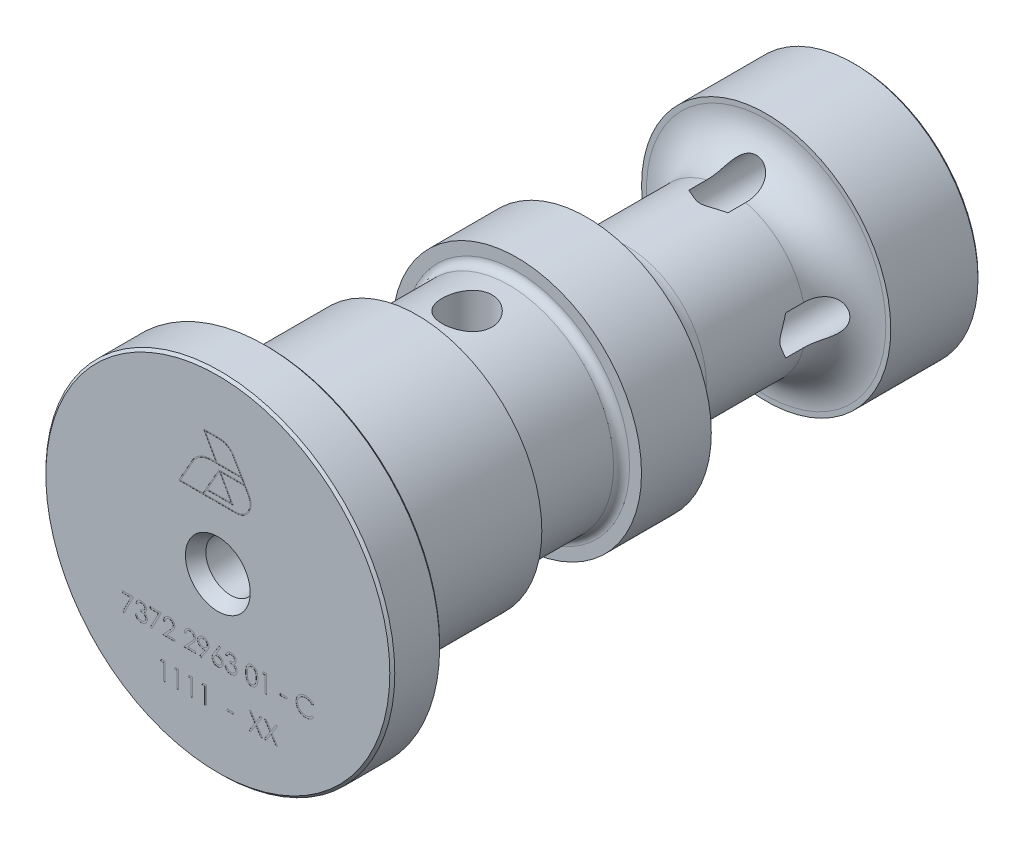
from build123d import *

# Parameters (mm, degrees)
CIRPATTERN1_COUNT       = 4
CUT_EXTRUDE2_DEPTH      = 69.618510622
CUT_EXTRUDE2_DEPTH_BACK = 69.618510622
SKETCH4_R               = 2.5
SKETCH5_W               = 0.692307692
SKETCH5_H               = 0.184615385
CUT_EXTRUDE3_DEPTH      = 0.01


with BuildPart() as part:
    # Sketch1 → Revolve1 (revolve)
    with BuildSketch(Plane(origin=(0, 0, 0), x_dir=(0, 0, -1), z_dir=(1, 0, 0)), mode=Mode.PRIVATE) as revolve1_sk:
        with BuildLine():
            Line((0, 3.25), (0, 17.25))
            Line((0, 17.25), (0.25, 17.5))
            Line((0.25, 17.5), (4.75, 17.5))
            Line((4.75, 17.5), (5, 17.25))
            Line((5, 17.25), (5, 14.4975))
            ThreePointArc((5, 14.4975), (5.585786438, 13.083286438), (7, 12.4975))
            Line((7, 12.4975), (20, 12.4975))
            Line((20, 12.4975), (20, 11.3))
            ThreePointArc((20, 11.3), (20.234314575, 10.734314575), (20.8, 10.5))
            Line((20.8, 10.5), (29.2, 10.5))
            ThreePointArc((29.2, 10.5), (29.765685425, 10.734314575), (30, 11.3))
            Line((30, 11.3), (30, 12.4975))
            Line((30, 12.4975), (37, 12.4975))
            Line((37, 12.4975), (37, 12))
            ThreePointArc((37, 12), (38.171572875, 9.171572875), (41, 8))
            Line((41, 8), (51, 8))
            ThreePointArc((51, 8), (53.828427125, 9.171572875), (55, 12))
            Line((55, 12), (55, 12.4975))
            Line((55, 12.4975), (63.75, 12.4975))
            Line((63.75, 12.4975), (64, 12.2475))
            Line((64, 12.2475), (64, 10))
            Line((64, 10), (63.5, 9.5))
            Line((63.5, 9.5), (60.25, 9.5))
            ThreePointArc((60.25, 9.5), (59.366116524, 9.133883476), (59, 8.25))
            Line((59, 8.25), (59, 4.25))
            Line((59, 4.25), (57.718282402, 3.51))
            Line((57.718282402, 3.51), (33, 3.51))
            Line((33, 3.51), (33, 3.4))
            Line((33, 3.4), (22.042926105, 3.4))
            Line((22.042926105, 3.4), (20, 0))
            Line((20, 0), (11, 0))
            Line((11, 0), (9.497848452, 2.5))
            Line((9.497848452, 2.5), (1.299038106, 2.5))
            Line((1.299038106, 2.5), (0, 3.25))
        make_face()
    revolve(revolve1_sk.sketch.rotate(Axis((0, 0, 67.498669623), (0, 0, -1)), 90), axis=Axis((0, 0, 67.498669623), (0, 0, -1)))

    # Sketch3 → Cut-Revolve3 (revolve, cut)
    with BuildSketch(Plane(origin=(0, 0, 0), x_dir=(0, 0, -1), z_dir=(1, 0, 0)), mode=Mode.PRIVATE) as cut_revolve3_sk:
        Polygon((66.818419238, -7.375), (66.818419238, -9.375), (49.201721238, -9.375), (48, -7.375), align=None)
    cut_revolve3 = revolve(cut_revolve3_sk.sketch.rotate(Axis((0, -7.375, -68.053965544), (0, 0, 1)), 79.038560762), axis=Axis((0, -7.375, -68.053965544), (0, 0, 1)), mode=Mode.SUBTRACT)

    # CirPattern1: Cut-Revolve3 ×4 about axis
    cirpattern1_axis = Axis((0, 0, 0), (0, 0, 1))
    for i in range(1, CIRPATTERN1_COUNT):
        add(cut_revolve3.rotate(cirpattern1_axis, i * 360 / CIRPATTERN1_COUNT), mode=Mode.SUBTRACT)

    # Sketch4 → Cut-Extrude2 (cut, two sides: drawn at the far end of the back side and taken through both)
    with BuildSketch(Plane(origin=(0, 0, 0), x_dir=(1, 0, 0), z_dir=(0, 1, 0)).offset(-CUT_EXTRUDE2_DEPTH_BACK)):
        with Locations(Location((0, 25, 0), (0, 0, 270))):
            Circle(SKETCH4_R)
    extrude(amount=CUT_EXTRUDE2_DEPTH + CUT_EXTRUDE2_DEPTH_BACK, mode=Mode.SUBTRACT)

    # Sketch5 → Cut-Extrude3 (cut)
    # profile 1 of 20: a face of its own
    with BuildSketch(Plane.XY):
        Polygon((-9.553846154, -6.221311831), (-8.446153846, -6.221311831), (-9.392307692, -8.067465677), (-9.531850962, -7.990662792), (-8.719831731, -6.405927215), (-9.553846154, -6.405927215), align=None)
    # profile 2 of 20: a face of its own
    with BuildSketch(Plane.XY):
        with BuildLine():
            Line((-8.053846154, -6.636696446), (-8.215384615, -6.636696446))
            add(Edge.make_bspline(
                [(-8.215384615, -6.636696446), (-8.211008275, -6.618576883), (-8.202452888, -6.583154619), (-8.184608421, -6.532545171), (-8.165168804, -6.484653074), (-8.141825836, -6.440375093), (-8.116364191, -6.398821372), (-8.087192506, -6.360934393), (-8.055656649, -6.325750583), (-8.020775246, -6.294526632), (-7.984194791, -6.266252371), (-7.945399844, -6.242145199), (-7.905170927, -6.221407063), (-7.863229316, -6.204322372), (-7.819450142, -6.191452103), (-7.774229193, -6.182114317), (-7.727447964, -6.176050316), (-7.695692061, -6.175458495), (-7.679567308, -6.175157985)],
                knots=[0, 0, 0, 0, 1.162005537, 2.271625781, 3.343758855, 4.383309926, 5.390229558, 6.379919256, 7.361854164, 8.333198761, 9.295911338, 10.242430842, 11.177959212, 12.116337295, 13.062827104, 14.020064771, 14.994644689, 16, 16, 16, 16], degree=3))
            add(Edge.make_bspline(
                [(-7.679567308, -6.175157985), (-7.656073326, -6.175867303), (-7.609597835, -6.177270468), (-7.541319696, -6.190083606), (-7.475477332, -6.210359389), (-7.412791433, -6.238374448), (-7.354564811, -6.272927924), (-7.302757629, -6.314052646), (-7.258072109, -6.360955143), (-7.220583572, -6.412760462), (-7.191230715, -6.468126153), (-7.169586295, -6.525109091), (-7.15640943, -6.583574105), (-7.154701715, -6.623049277), (-7.153846154, -6.642826254)],
                knots=[0, 0, 0, 0, 1.083050992, 2.142477498, 3.193116406, 4.255571735, 5.30263384, 6.308962982, 7.297363603, 8.282367274, 9.249857812, 10.179914175, 11.08814088, 12, 12, 12, 12], degree=3))
            add(Edge.make_bspline(
                [(-7.153846154, -6.642826254), (-7.154444572, -6.66185832), (-7.155615584, -6.699101119), (-7.165558632, -6.753472175), (-7.182291568, -6.804716426), (-7.205470303, -6.853049596), (-7.235474528, -6.898165227), (-7.271820487, -6.940164828), (-7.314764713, -6.979234681), (-7.347308167, -7.001616124), (-7.3640625, -7.013138754)],
                knots=[0, 0, 0, 0, 1.024540389, 2.004866551, 2.965041327, 3.920577974, 4.882998113, 5.874504559, 6.905732034, 8, 8, 8, 8], degree=3))
            add(Edge.make_bspline(
                [(-7.3640625, -7.013138754), (-7.344914741, -7.022384671), (-7.306977491, -7.040703506), (-7.25526579, -7.076629324), (-7.208322883, -7.118109731), (-7.182143827, -7.150480239), (-7.168990385, -7.166744523)],
                knots=[0, 0, 0, 0, 1.015518401, 2.012035669, 3.001164323, 4, 4, 4, 4], degree=3))
            add(Edge.make_bspline(
                [(-7.168990385, -7.166744523), (-7.160329123, -7.178602795), (-7.143148433, -7.202125152), (-7.121941588, -7.239943886), (-7.102702614, -7.278181795), (-7.087711073, -7.317863775), (-7.076101656, -7.358529896), (-7.067803125, -7.400249986), (-7.062647853, -7.443058111), (-7.061909569, -7.472018815), (-7.061538462, -7.486576254)],
                knots=[0, 0, 0, 0, 1.025084078, 2.033381695, 3.024893161, 4.013698104, 4.991890475, 5.976764909, 6.982997093, 8, 8, 8, 8], degree=3))
            add(Edge.make_bspline(
                [(-7.061538462, -7.486576254), (-7.062461354, -7.511781253), (-7.064302796, -7.562072637), (-7.080762035, -7.636373923), (-7.106277416, -7.709004181), (-7.142512411, -7.778471241), (-7.186672844, -7.843466866), (-7.239210897, -7.901620396), (-7.299529621, -7.95160825), (-7.366801098, -7.99337351), (-7.439684192, -8.02675987), (-7.517637354, -8.049932269), (-7.599537382, -8.065024497), (-7.655701135, -8.066642887), (-7.684254808, -8.067465677)],
                knots=[0, 0, 0, 0, 0.955779014, 1.907060117, 2.875433937, 3.871313158, 4.872415639, 5.851225146, 6.836215519, 7.83643374, 8.849228613, 9.86973379, 10.916971861, 12, 12, 12, 12], degree=3))
            add(Edge.make_bspline(
                [(-7.684254808, -8.067465677), (-7.703499019, -8.067019167), (-7.74136521, -8.066140585), (-7.797033295, -8.060134447), (-7.850170169, -8.04916473), (-7.900847677, -8.034403031), (-7.949110838, -8.015687277), (-7.994812378, -7.992380518), (-8.038233466, -7.964963175), (-8.078964355, -7.933111615), (-8.11700019, -7.897481212), (-8.151330163, -7.857439435), (-8.182526628, -7.813726485), (-8.20975427, -7.765834627), (-8.234253275, -7.714382781), (-8.254403481, -7.658712124), (-8.272138916, -7.599320342), (-8.280384698, -7.557931789), (-8.284615385, -7.536696446)],
                knots=[0, 0, 0, 0, 1.048658725, 2.063410685, 3.046034179, 4.001477787, 4.936774919, 5.862367409, 6.792675028, 7.730719943, 8.675894397, 9.627829632, 10.600096036, 11.597688215, 12.626045268, 13.701542398, 14.82072376, 16, 16, 16, 16], degree=3))
            Line((-8.284615385, -7.536696446), (-8.123076923, -7.536696446))
            add(Edge.make_bspline(
                [(-8.123076923, -7.536696446), (-8.118868373, -7.550555939), (-8.110682378, -7.577513856), (-8.096748168, -7.616311727), (-8.080873056, -7.651878726), (-8.063842712, -7.68447576), (-8.045956654, -7.714423853), (-8.025943264, -7.7409311), (-8.005284846, -7.765161775), (-7.989712608, -7.77881329), (-7.982091346, -7.785494523)],
                knots=[0, 0, 0, 0, 1.198163088, 2.33053128, 3.407730985, 4.417276592, 5.372219308, 6.28897303, 7.162600585, 8, 8, 8, 8], degree=3))
            add(Edge.make_bspline(
                [(-7.982091346, -7.785494523), (-7.972013107, -7.793264523), (-7.951887737, -7.80878054), (-7.919092647, -7.828581377), (-7.884602134, -7.845738476), (-7.847668873, -7.858844377), (-7.809089848, -7.869941459), (-7.768241489, -7.877203441), (-7.725484177, -7.882185929), (-7.696289328, -7.882625608), (-7.681370192, -7.882850292)],
                knots=[0, 0, 0, 0, 0.946170439, 1.889420265, 2.845303464, 3.807233317, 4.801018734, 5.828864929, 6.890507805, 8, 8, 8, 8], degree=3))
            add(Edge.make_bspline(
                [(-7.681370192, -7.882850292), (-7.664525534, -7.882533541), (-7.631587258, -7.881914161), (-7.583524759, -7.876218084), (-7.537800929, -7.867922442), (-7.494923424, -7.855110051), (-7.454330592, -7.839279899), (-7.416591458, -7.819403576), (-7.381210603, -7.796083434), (-7.348641195, -7.769577581), (-7.319354934, -7.740560812), (-7.293568898, -7.710211232), (-7.271647644, -7.678656806), (-7.253964661, -7.645722915), (-7.240001521, -7.61154594), (-7.230495875, -7.576029971), (-7.223886524, -7.539465662), (-7.223348266, -7.514610764), (-7.223076923, -7.502081062)],
                knots=[0, 0, 0, 0, 1.217147791, 2.380027433, 3.494444702, 4.572153297, 5.609568379, 6.639424714, 7.649109417, 8.668170816, 9.669597737, 10.625200337, 11.543417969, 12.441394052, 13.322311151, 14.205496177, 15.095365482, 16, 16, 16, 16], degree=3))
            add(Edge.make_bspline(
                [(-7.223076923, -7.502081062), (-7.223863935, -7.485309516), (-7.225434044, -7.451849877), (-7.237421313, -7.402623696), (-7.257138443, -7.355194513), (-7.284741449, -7.310371535), (-7.318342681, -7.268829643), (-7.357616062, -7.231764309), (-7.402887722, -7.201179691), (-7.444555083, -7.180048382), (-7.481462878, -7.165629314), (-7.513047933, -7.156025047), (-7.548408472, -7.14789231), (-7.58711688, -7.140325999), (-7.62946482, -7.133886448), (-7.675406188, -7.128516372), (-7.724950294, -7.124219493), (-7.759248607, -7.122300644), (-7.776923077, -7.121311831)],
                knots=[0, 0, 0, 0, 1.07054697, 2.135767047, 3.216561865, 4.33974944, 5.486079747, 6.621378074, 7.775625952, 8.963672916, 9.598146892, 10.304877434, 11.070270905, 11.915000392, 12.823868403, 13.805723172, 14.86925407, 16, 16, 16, 16], degree=3))
            Line((-7.776923077, -7.121311831), (-7.776923077, -6.936696446))
            add(Edge.make_bspline(
                [(-7.776923077, -6.936696446), (-7.754653906, -6.936318547), (-7.711034071, -6.935578336), (-7.647317, -6.926625645), (-7.586387868, -6.914241322), (-7.529596972, -6.895271794), (-7.477834776, -6.873239642), (-7.432927552, -6.847601362), (-7.395504448, -6.819102348), (-7.365747326, -6.787302721), (-7.343360865, -6.753197839), (-7.326992798, -6.71765213), (-7.317324059, -6.680354041), (-7.316033373, -6.65489964), (-7.315384615, -6.6421051)],
                knots=[0, 0, 0, 0, 1.321986639, 2.589447074, 3.816329219, 5.01088745, 6.139805852, 7.153945165, 8.075214402, 8.924034688, 9.728124013, 10.488707548, 11.240355623, 12, 12, 12, 12], degree=3))
            add(Edge.make_bspline(
                [(-7.315384615, -6.6421051), (-7.315597741, -6.632705117), (-7.316021744, -6.614004296), (-7.321368916, -6.586682832), (-7.329404137, -6.560196631), (-7.340450855, -6.534658329), (-7.355236671, -6.510245045), (-7.372931179, -6.486748643), (-7.394000487, -6.464303271), (-7.41814386, -6.443381964), (-7.444069931, -6.423443499), (-7.472484101, -6.406516486), (-7.502529637, -6.392041882), (-7.534239802, -6.380105567), (-7.567717503, -6.371126504), (-7.602805447, -6.3646795), (-7.639570542, -6.360648706), (-7.664653147, -6.360068378), (-7.677403846, -6.359773369)],
                knots=[0, 0, 0, 0, 0.884392785, 1.759457502, 2.611959086, 3.489218968, 4.37281399, 5.2945488, 6.255912374, 7.266815255, 8.301784654, 9.332968512, 10.37626691, 11.440494194, 12.520033166, 13.637162961, 14.798855837, 16, 16, 16, 16], degree=3))
            add(Edge.make_bspline(
                [(-7.677403846, -6.359773369), (-7.69789899, -6.360488927), (-7.737930772, -6.361886577), (-7.795641301, -6.374128127), (-7.849291244, -6.393659713), (-7.890299701, -6.416973837), (-7.920582168, -6.439988346), (-7.942221736, -6.460087859), (-7.963472284, -6.48242474), (-7.982935775, -6.508374761), (-8.002619534, -6.536180539), (-8.020539595, -6.567255575), (-8.037953151, -6.600789264), (-8.04844589, -6.62449559), (-8.053846154, -6.636696446)],
                knots=[0, 0, 0, 0, 1.472543308, 2.876219568, 4.221790263, 5.565193594, 6.249813518, 6.953379497, 7.687249741, 8.463570142, 9.283606569, 10.136032583, 11.040678096, 12, 12, 12, 12], degree=3))
        make_face()
    # profile 3 of 20: a face of its own
    with BuildSketch(Plane.XY):
        Polygon((-6.784615385, -6.221311831), (-5.676923077, -6.221311831), (-6.623076923, -8.067465677), (-6.762620192, -7.990662792), (-5.950600962, -6.405927215), (-6.784615385, -6.405927215), align=None)
    # profile 4 of 20: a face of its own
    with BuildSketch(Plane.XY):
        with BuildLine():
            Line((-5.284615385, -6.775157985), (-5.446153846, -6.775157985))
            add(Edge.make_bspline(
                [(-5.446153846, -6.775157985), (-5.445101025, -6.753727242), (-5.443033311, -6.711637835), (-5.433350191, -6.650271254), (-5.419494883, -6.591614501), (-5.399904992, -6.536138545), (-5.375576049, -6.483352873), (-5.346400606, -6.43346715), (-5.311843769, -6.386671682), (-5.272651734, -6.343400277), (-5.230085006, -6.303703812), (-5.184156237, -6.269423973), (-5.13589308, -6.240460599), (-5.085441961, -6.216247389), (-5.032233671, -6.198072611), (-4.976751058, -6.184587196), (-4.918750359, -6.176473647), (-4.879232634, -6.175601529), (-4.859134615, -6.175157985)],
                knots=[0, 0, 0, 0, 1.10065271, 2.161652631, 3.183658789, 4.190468796, 5.17591951, 6.163126047, 7.15150782, 8.156236427, 9.156009102, 10.134482811, 11.092018607, 12.041330605, 13.001268258, 13.972401359, 14.968799086, 16, 16, 16, 16], degree=3))
            add(Edge.make_bspline(
                [(-4.859134615, -6.175157985), (-4.83939732, -6.175620048), (-4.80061424, -6.176527986), (-4.744010918, -6.184325087), (-4.690125453, -6.196537105), (-4.639063173, -6.213670748), (-4.591231482, -6.236702739), (-4.546271059, -6.264370045), (-4.503646642, -6.296368815), (-4.465277439, -6.334042205), (-4.430044713, -6.374260574), (-4.399649267, -6.41719721), (-4.373619641, -6.4615437), (-4.351923119, -6.507638204), (-4.335951391, -6.555914733), (-4.323825455, -6.605670437), (-4.316971357, -6.65742034), (-4.315919425, -6.692446568), (-4.315384615, -6.710254139)],
                knots=[0, 0, 0, 0, 1.111607364, 2.184268762, 3.212621178, 4.221274766, 5.211760367, 6.196651075, 7.1921475, 8.207485113, 9.220403448, 10.201281604, 11.166441695, 12.114753415, 13.065576456, 14.026450734, 14.996634279, 16, 16, 16, 16], degree=3))
            add(Edge.make_bspline(
                [(-4.315384615, -6.710254139), (-4.316252033, -6.735325469), (-4.317971646, -6.785028164), (-4.332811721, -6.858161833), (-4.355739657, -6.929084435), (-4.383548643, -6.986159376), (-4.411639221, -7.031918921), (-4.436417402, -7.06993268), (-4.466067183, -7.110471979), (-4.500317281, -7.153945121), (-4.53865101, -7.200485083), (-4.581344268, -7.250110963), (-4.628723194, -7.302295691), (-4.661975974, -7.337938681), (-4.679206731, -7.356407985)],
                knots=[0, 0, 0, 0, 1.184203166, 2.347625244, 3.513805382, 4.700623107, 5.337941753, 6.051866363, 6.845199593, 7.711357327, 8.668078039, 9.695487809, 10.805859518, 12, 12, 12, 12], degree=3))
            Line((-4.679206731, -7.356407985), (-5.129567308, -7.836696446))
            Line((-5.129567308, -7.836696446), (-4.292307692, -7.836696446))
            Line((-4.292307692, -7.836696446), (-4.292307692, -8.021311831))
            Line((-4.292307692, -8.021311831), (-5.515384615, -8.021311831))
            Line((-5.515384615, -8.021311831), (-4.817307692, -7.276359908))
            add(Edge.make_bspline(
                [(-4.817307692, -7.276359908), (-4.800311636, -7.258617922), (-4.767665691, -7.224539197), (-4.721491794, -7.174785675), (-4.680020315, -7.128628768), (-4.642982798, -7.086155686), (-4.61118271, -7.046745165), (-4.582962705, -7.011673603), (-4.560351829, -6.979399886), (-4.535812483, -6.941990428), (-4.512045293, -6.896315522), (-4.491621795, -6.840498196), (-4.479168445, -6.783038466), (-4.477674529, -6.744208847), (-4.476923077, -6.724677215)],
                knots=[0, 0, 0, 0, 1.329631726, 2.553950428, 3.673215718, 4.687767853, 5.603093632, 6.413772471, 7.123043292, 7.734684054, 8.834405432, 9.900288307, 10.943827018, 12, 12, 12, 12], degree=3))
            add(Edge.make_bspline(
                [(-4.476923077, -6.724677215), (-4.47725003, -6.712395353), (-4.477894392, -6.688190162), (-4.483581208, -6.652701486), (-4.492175182, -6.618468153), (-4.504489887, -6.585384863), (-4.520744782, -6.553784242), (-4.540531091, -6.523627824), (-4.563360267, -6.494473499), (-4.589769491, -6.467137517), (-4.61878113, -6.442101468), (-4.649429601, -6.419923367), (-4.681855369, -6.401388967), (-4.715921717, -6.386195169), (-4.751533673, -6.374276401), (-4.788760113, -6.366017703), (-4.827498179, -6.360832426), (-4.853949691, -6.360130852), (-4.867427885, -6.359773369)],
                knots=[0, 0, 0, 0, 0.991446411, 1.95395049, 2.89581595, 3.838931463, 4.798493298, 5.75982156, 6.748411868, 7.785213223, 8.824556874, 9.840280684, 10.836137867, 11.835679398, 12.848801643, 13.863922112, 14.911575587, 16, 16, 16, 16], degree=3))
            add(Edge.make_bspline(
                [(-4.867427885, -6.359773369), (-4.881504313, -6.3601411), (-4.909148094, -6.360863263), (-4.949735025, -6.365914919), (-4.988453425, -6.374629922), (-5.025400689, -6.386549355), (-5.060639333, -6.401699466), (-5.093997985, -6.420569506), (-5.125401756, -6.443086731), (-5.154909683, -6.46861616), (-5.182096872, -6.497039498), (-5.205983836, -6.528724621), (-5.226855615, -6.563093006), (-5.245066078, -6.600051918), (-5.259854719, -6.639936719), (-5.271155196, -6.682605825), (-5.280097003, -6.727873964), (-5.283084242, -6.759134864), (-5.284615385, -6.775157985)],
                knots=[0, 0, 0, 0, 1.031018746, 2.02475058, 2.990194455, 3.934040569, 4.864654155, 5.795059489, 6.735614925, 7.690564532, 8.649604399, 9.611025574, 10.590972636, 11.591080095, 12.624614302, 13.701020113, 14.821632451, 16, 16, 16, 16], degree=3))
        make_face()
    # profile 5 of 20: a face of its own
    with BuildSketch(Plane.XY):
        with BuildLine():
            Line((-3.207692308, -6.775157985), (-3.369230769, -6.775157985))
            add(Edge.make_bspline(
                [(-3.369230769, -6.775157985), (-3.368177948, -6.753727242), (-3.366110234, -6.711637835), (-3.356427114, -6.650271254), (-3.342571806, -6.591614501), (-3.322981915, -6.536138545), (-3.298652972, -6.483352873), (-3.26947753, -6.43346715), (-3.234920692, -6.386671682), (-3.195728658, -6.343400277), (-3.153161929, -6.303703812), (-3.10723316, -6.269423973), (-3.058970003, -6.240460599), (-3.008518884, -6.216247389), (-2.955310594, -6.198072611), (-2.899827981, -6.184587196), (-2.841827282, -6.176473647), (-2.802309557, -6.175601529), (-2.782211538, -6.175157985)],
                knots=[0, 0, 0, 0, 1.10065271, 2.161652631, 3.183658789, 4.190468796, 5.17591951, 6.163126047, 7.15150782, 8.156236427, 9.156009102, 10.134482811, 11.092018607, 12.041330605, 13.001268258, 13.972401359, 14.968799086, 16, 16, 16, 16], degree=3))
            add(Edge.make_bspline(
                [(-2.782211538, -6.175157985), (-2.762474243, -6.175620048), (-2.723691163, -6.176527986), (-2.667087841, -6.184325087), (-2.613202376, -6.196537105), (-2.562140096, -6.213670748), (-2.514308405, -6.236702739), (-2.469347982, -6.264370045), (-2.426723565, -6.296368815), (-2.388354362, -6.334042205), (-2.353121636, -6.374260574), (-2.322726191, -6.41719721), (-2.296696564, -6.4615437), (-2.275000043, -6.507638204), (-2.259028314, -6.555914733), (-2.246902378, -6.605670437), (-2.24004828, -6.65742034), (-2.238996348, -6.692446568), (-2.238461538, -6.710254139)],
                knots=[0, 0, 0, 0, 1.111607364, 2.184268762, 3.212621178, 4.221274766, 5.211760367, 6.196651075, 7.1921475, 8.207485113, 9.220403448, 10.201281604, 11.166441695, 12.114753415, 13.065576456, 14.026450734, 14.996634279, 16, 16, 16, 16], degree=3))
            add(Edge.make_bspline(
                [(-2.238461538, -6.710254139), (-2.239328956, -6.735325469), (-2.241048569, -6.785028164), (-2.255888644, -6.858161833), (-2.27881658, -6.929084435), (-2.306625566, -6.986159376), (-2.334716144, -7.031918921), (-2.359494325, -7.06993268), (-2.389144106, -7.110471979), (-2.423394204, -7.153945121), (-2.461727933, -7.200485083), (-2.504421191, -7.250110963), (-2.551800118, -7.302295691), (-2.585052897, -7.337938681), (-2.602283654, -7.356407985)],
                knots=[0, 0, 0, 0, 1.184203166, 2.347625244, 3.513805382, 4.700623107, 5.337941753, 6.051866363, 6.845199593, 7.711357327, 8.668078039, 9.695487809, 10.805859518, 12, 12, 12, 12], degree=3))
            Line((-2.602283654, -7.356407985), (-3.052644231, -7.836696446))
            Line((-3.052644231, -7.836696446), (-2.215384615, -7.836696446))
            Line((-2.215384615, -7.836696446), (-2.215384615, -8.021311831))
            Line((-2.215384615, -8.021311831), (-3.438461538, -8.021311831))
            Line((-3.438461538, -8.021311831), (-2.740384615, -7.276359908))
            add(Edge.make_bspline(
                [(-2.740384615, -7.276359908), (-2.723388559, -7.258617922), (-2.690742614, -7.224539197), (-2.644568717, -7.174785675), (-2.603097238, -7.128628768), (-2.566059721, -7.086155686), (-2.534259633, -7.046745165), (-2.506039628, -7.011673603), (-2.483428752, -6.979399886), (-2.458889406, -6.941990428), (-2.435122216, -6.896315522), (-2.414698718, -6.840498196), (-2.402245368, -6.783038466), (-2.400751452, -6.744208847), (-2.4, -6.724677215)],
                knots=[0, 0, 0, 0, 1.329631726, 2.553950428, 3.673215718, 4.687767853, 5.603093632, 6.413772471, 7.123043292, 7.734684054, 8.834405432, 9.900288307, 10.943827018, 12, 12, 12, 12], degree=3))
            add(Edge.make_bspline(
                [(-2.4, -6.724677215), (-2.400326953, -6.712395353), (-2.400971315, -6.688190162), (-2.406658131, -6.652701486), (-2.415252106, -6.618468153), (-2.42756681, -6.585384863), (-2.443821705, -6.553784242), (-2.463608014, -6.523627824), (-2.48643719, -6.494473499), (-2.512846414, -6.467137517), (-2.541858053, -6.442101468), (-2.572506524, -6.419923367), (-2.604932292, -6.401388967), (-2.63899864, -6.386195169), (-2.674610596, -6.374276401), (-2.711837036, -6.366017703), (-2.750575102, -6.360832426), (-2.777026614, -6.360130852), (-2.790504808, -6.359773369)],
                knots=[0, 0, 0, 0, 0.991446411, 1.95395049, 2.89581595, 3.838931463, 4.798493298, 5.75982156, 6.748411868, 7.785213223, 8.824556874, 9.840280684, 10.836137867, 11.835679398, 12.848801643, 13.863922112, 14.911575587, 16, 16, 16, 16], degree=3))
            add(Edge.make_bspline(
                [(-2.790504808, -6.359773369), (-2.804581236, -6.3601411), (-2.832225017, -6.360863263), (-2.872811948, -6.365914919), (-2.911530348, -6.374629922), (-2.948477612, -6.386549355), (-2.983716256, -6.401699466), (-3.017074908, -6.420569506), (-3.048478679, -6.443086731), (-3.077986606, -6.46861616), (-3.105173795, -6.497039498), (-3.12906076, -6.528724621), (-3.149932538, -6.563093006), (-3.168143001, -6.600051918), (-3.182931642, -6.639936719), (-3.194232119, -6.682605825), (-3.203173926, -6.727873964), (-3.206161165, -6.759134864), (-3.207692308, -6.775157985)],
                knots=[0, 0, 0, 0, 1.031018746, 2.02475058, 2.990194455, 3.934040569, 4.864654155, 5.795059489, 6.735614925, 7.690564532, 8.649604399, 9.611025574, 10.590972636, 11.591080095, 12.624614302, 13.701020113, 14.821632451, 16, 16, 16, 16], degree=3))
        make_face()
    # profile 6 of 20: a face of its own
    with BuildSketch(Plane.XY):
        with BuildLine():
            Line((-1.661538462, -8.067465677), (-1.790625, -7.977682023))
            Line((-1.790625, -7.977682023), (-1.290144231, -7.246071446))
            add(Edge.make_bspline(
                [(-1.290144231, -7.246071446), (-1.322076609, -7.24997645), (-1.384953242, -7.257665621), (-1.448280895, -7.259078186), (-1.479447115, -7.259773369)],
                knots=[0, 0, 0, 0, 1.015715272, 2, 2, 2, 2], degree=3))
            add(Edge.make_bspline(
                [(-1.479447115, -7.259773369), (-1.498343026, -7.259289387), (-1.535434045, -7.258339372), (-1.589964609, -7.2508093), (-1.642362898, -7.239212091), (-1.692489995, -7.221907017), (-1.740534312, -7.200400509), (-1.786390964, -7.173731188), (-1.829998222, -7.142356524), (-1.870887747, -7.106442414), (-1.908076642, -7.067007987), (-1.941208623, -7.025270799), (-1.968744063, -6.980746014), (-1.991617735, -6.934341901), (-2.008964826, -6.885391492), (-2.021596988, -6.834451801), (-2.029374199, -6.781165814), (-2.030299448, -6.744895746), (-2.030769231, -6.7264801)],
                knots=[0, 0, 0, 0, 1.060718605, 2.082097864, 3.085795603, 4.069760067, 5.054557537, 6.03741023, 7.043284206, 8.066802108, 9.088538119, 10.083643548, 11.053783639, 12.022749082, 12.983451788, 13.964007469, 14.966251758, 16, 16, 16, 16], degree=3))
            add(Edge.make_bspline(
                [(-2.030769231, -6.7264801), (-2.029877236, -6.701296222), (-2.02812643, -6.651865377), (-2.014035764, -6.579642296), (-1.990861876, -6.511352073), (-1.958550139, -6.447174259), (-1.917852282, -6.38803205), (-1.868939293, -6.334747623), (-1.812108683, -6.288078841), (-1.748655073, -6.247962458), (-1.68007352, -6.215698745), (-1.608243924, -6.191918534), (-1.533716662, -6.177930606), (-1.483230432, -6.176086449), (-1.4578125, -6.175157985)],
                knots=[0, 0, 0, 0, 1.022988612, 2.007919123, 2.978103895, 3.94594894, 4.918897164, 5.887013414, 6.875921846, 7.89917871, 8.930658928, 9.948724884, 10.967259574, 12, 12, 12, 12], degree=3))
            add(Edge.make_bspline(
                [(-1.4578125, -6.175157985), (-1.432875598, -6.176099211), (-1.383602632, -6.177958987), (-1.311145428, -6.191579314), (-1.241747191, -6.214535317), (-1.175792626, -6.246258807), (-1.114726643, -6.286023845), (-1.059813369, -6.333407314), (-1.012305948, -6.388438728), (-0.972282238, -6.449787095), (-0.940154789, -6.515701542), (-0.916974758, -6.584504702), (-0.902705572, -6.655701759), (-0.900907461, -6.703938917), (-0.9, -6.728282985)],
                knots=[0, 0, 0, 0, 1.026385292, 2.028040595, 3.023318987, 4.028184125, 5.03290303, 6.015178782, 7.004435299, 8.016004309, 9.023023918, 10.015172535, 10.998308025, 12, 12, 12, 12], degree=3))
            add(Edge.make_bspline(
                [(-0.9, -6.728282985), (-0.900606039, -6.747179779), (-0.901835237, -6.7855072), (-0.910442481, -6.843739948), (-0.925058576, -6.903114866), (-0.941645164, -6.953371687), (-0.957655993, -6.994878889), (-0.972725146, -7.027665416), (-0.989445683, -7.062174637), (-1.008946762, -7.098044697), (-1.029910229, -7.135732858), (-1.053597857, -7.174861111), (-1.079469294, -7.215481965), (-1.097896007, -7.242866182), (-1.107331731, -7.256888754)],
                knots=[0, 0, 0, 0, 1.179839688, 2.393009684, 3.667231171, 4.993948276, 5.694988576, 6.444077775, 7.246288328, 8.089075292, 8.993003841, 9.939041771, 10.944649915, 12, 12, 12, 12], degree=3))
            Line((-1.107331731, -7.256888754), (-1.661538462, -8.067465677))
        make_face()
        with BuildLine():
            add(Edge.make_bspline(
                [(-1.449519231, -7.075157985), (-1.435204595, -7.07476693), (-1.407338865, -7.07400568), (-1.366516254, -7.069372356), (-1.327983807, -7.061157163), (-1.291638593, -7.049369882), (-1.257116186, -7.035146453), (-1.224964932, -7.017037431), (-1.195157922, -6.995428876), (-1.167495559, -6.971149439), (-1.142931217, -6.944174854), (-1.121051944, -6.915942056), (-1.10245508, -6.886327114), (-1.087765395, -6.85495915), (-1.075687613, -6.822601729), (-1.067346921, -6.788733774), (-1.062726407, -6.75353174), (-1.06193874, -6.729618144), (-1.061538462, -6.717465677)],
                knots=[0, 0, 0, 0, 1.163407946, 2.26475976, 3.333800367, 4.359385343, 5.366239384, 6.363380779, 7.350133999, 8.353570782, 9.349036268, 10.310270964, 11.253520213, 12.184142, 13.120487599, 14.056272588, 15.012232024, 16, 16, 16, 16], degree=3))
            add(Edge.make_bspline(
                [(-1.061538462, -6.717465677), (-1.061882863, -6.705308135), (-1.062561548, -6.681350207), (-1.068006445, -6.646096055), (-1.077585131, -6.612310949), (-1.09043738, -6.579809928), (-1.107367788, -6.548860023), (-1.127683867, -6.51907266), (-1.151820555, -6.490636709), (-1.179593303, -6.464220946), (-1.209542502, -6.439870598), (-1.241459331, -6.418380616), (-1.275080716, -6.400369715), (-1.31020154, -6.385507387), (-1.346894976, -6.373909331), (-1.385139313, -6.365568972), (-1.425127807, -6.360954927), (-1.452272469, -6.360172238), (-1.466105769, -6.359773369)],
                knots=[0, 0, 0, 0, 0.972161553, 1.915763587, 2.844109794, 3.775983486, 4.705125789, 5.659731448, 6.655561913, 7.682237399, 8.721216875, 9.739758359, 10.754845918, 11.767244016, 12.7857855, 13.828538656, 14.893392813, 16, 16, 16, 16], degree=3))
            add(Edge.make_bspline(
                [(-1.466105769, -6.359773369), (-1.479818762, -6.360172883), (-1.506723542, -6.360956725), (-1.546356538, -6.365560202), (-1.584342282, -6.373965422), (-1.620929401, -6.385502015), (-1.656049181, -6.400370823), (-1.68966898, -6.418381559), (-1.721593275, -6.439865651), (-1.751513759, -6.464240105), (-1.779335548, -6.490513752), (-1.803057249, -6.519197229), (-1.823419822, -6.548844528), (-1.840326966, -6.579814046), (-1.853185403, -6.61230985), (-1.862762433, -6.646096353), (-1.868207775, -6.681350129), (-1.868886399, -6.705308109), (-1.869230769, -6.717465677)],
                knots=[0, 0, 0, 0, 1.099389452, 2.15699305, 3.192601482, 4.213358962, 5.227959689, 6.245255729, 7.266013209, 8.307253147, 9.336162325, 10.327954924, 11.284637477, 12.215801273, 13.149702402, 14.080068371, 15.025723358, 16, 16, 16, 16], degree=3))
            add(Edge.make_bspline(
                [(-1.869230769, -6.717465677), (-1.86891915, -6.729627608), (-1.86830458, -6.753613161), (-1.862376003, -6.788855306), (-1.852461459, -6.822637806), (-1.839182915, -6.855289141), (-1.821696383, -6.886491811), (-1.800238404, -6.916097883), (-1.77508698, -6.944442971), (-1.746578329, -6.97108668), (-1.715377561, -6.995542085), (-1.68205352, -7.016900567), (-1.64717989, -7.034937824), (-1.610633908, -7.049410536), (-1.572686411, -7.061039391), (-1.532996343, -7.069357215), (-1.491694964, -7.073961238), (-1.463712688, -7.074755242), (-1.449519231, -7.075157985)],
                knots=[0, 0, 0, 0, 0.952633368, 1.87876736, 2.791047057, 3.707742249, 4.635551637, 5.587206343, 6.568248508, 7.601284464, 8.641511608, 9.671105535, 10.699146789, 11.713763218, 12.747829548, 13.806491675, 14.887386225, 16, 16, 16, 16], degree=3))
        make_face(mode=Mode.SUBTRACT)
    # profile 7 of 20: a face of its own
    with BuildSketch(Plane.XY):
        with BuildLine():
            Line((0.161538462, -6.175157985), (0.286298077, -6.272874331))
            Line((0.286298077, -6.272874331), (-0.189302885, -7.000157985))
            add(Edge.make_bspline(
                [(-0.189302885, -7.000157985), (-0.157638171, -6.995110856), (-0.095872566, -6.985265862), (-0.033352961, -6.983641776), (-0.002884615, -6.982850292)],
                knots=[0, 0, 0, 0, 1.025318673, 2, 2, 2, 2], degree=3))
            add(Edge.make_bspline(
                [(-0.002884615, -6.982850292), (0.015410732, -6.983334885), (0.051305462, -6.984285637), (0.104047742, -6.991799135), (0.154739545, -7.003493854), (0.203267782, -7.020609785), (0.249694045, -7.042466944), (0.294283806, -7.068664401), (0.336199137, -7.100552948), (0.37597974, -7.13617495), (0.412096534, -7.175629393), (0.444072791, -7.217492939), (0.470932284, -7.261721963), (0.492724586, -7.308294065), (0.509647095, -7.357137456), (0.521983599, -7.408189642), (0.529275961, -7.461485827), (0.530266213, -7.497731746), (0.530769231, -7.516143562)],
                knots=[0, 0, 0, 0, 1.044136307, 2.048553127, 3.035567123, 4.010001674, 4.980053131, 5.96154148, 6.956538004, 7.981742224, 9.006487041, 10.005615874, 10.984750588, 11.954802044, 12.935714515, 13.930994945, 14.949008866, 16, 16, 16, 16], degree=3))
            add(Edge.make_bspline(
                [(0.530769231, -7.516143562), (0.530037348, -7.541333124), (0.528597177, -7.59090022), (0.514246653, -7.663093955), (0.491947407, -7.731870677), (0.46007325, -7.796132308), (0.42048231, -7.855790773), (0.372202405, -7.908651869), (0.316945754, -7.95579646), (0.254466829, -7.995219864), (0.18722759, -8.027415719), (0.11658942, -8.0505407), (0.043238317, -8.064777913), (-0.00654691, -8.066562795), (-0.031730769, -8.067465677)],
                knots=[0, 0, 0, 0, 1.031375318, 2.029502543, 3.004789286, 3.987476834, 4.960371455, 5.9300674, 6.912260825, 7.929083631, 8.949397511, 9.960523116, 10.96833055, 12, 12, 12, 12], degree=3))
            add(Edge.make_bspline(
                [(-0.031730769, -8.067465677), (-0.05595193, -8.066679743), (-0.103929807, -8.065122944), (-0.174506673, -8.051254748), (-0.242321939, -8.028776809), (-0.306900478, -7.997809466), (-0.366722507, -7.958693983), (-0.420241977, -7.911604811), (-0.467192033, -7.857548515), (-0.506264695, -7.796533479), (-0.5372549, -7.730967215), (-0.560495433, -7.662599535), (-0.574070644, -7.591679544), (-0.575967616, -7.54360353), (-0.576923077, -7.519388754)],
                knots=[0, 0, 0, 0, 1.012016664, 2.004627821, 2.994792927, 3.992885782, 4.990978636, 5.973936114, 6.964471063, 7.975201453, 8.993600317, 9.990122807, 10.98767138, 12, 12, 12, 12], degree=3))
            add(Edge.make_bspline(
                [(-0.576923077, -7.519388754), (-0.576315477, -7.50085154), (-0.575074873, -7.46300209), (-0.566412558, -7.405677733), (-0.552493521, -7.347022891), (-0.536905394, -7.297263591), (-0.52043508, -7.256500523), (-0.50672806, -7.223635871), (-0.489667148, -7.18981589), (-0.471475123, -7.153880877), (-0.450514447, -7.11675694), (-0.427723542, -7.077823625), (-0.402472293, -7.037700119), (-0.384770495, -7.010471676), (-0.375721154, -6.996552215)],
                knots=[0, 0, 0, 0, 1.173818275, 2.396712641, 3.66331629, 4.989737886, 5.693666774, 6.447286557, 7.243889047, 8.091586357, 8.998013824, 9.943181721, 10.948533338, 12, 12, 12, 12], degree=3))
            Line((-0.375721154, -6.996552215), (0.161538462, -6.175157985))
        make_face()
        with BuildLine():
            add(Edge.make_bspline(
                [(-0.036778846, -7.167465677), (-0.050490419, -7.167871124), (-0.077392413, -7.168666606), (-0.116811877, -7.173159267), (-0.154018577, -7.18167234), (-0.189439937, -7.192681925), (-0.222697875, -7.207680623), (-0.254204686, -7.225653324), (-0.283597745, -7.247186198), (-0.310733568, -7.271494382), (-0.33532374, -7.298132993), (-0.356503335, -7.326658935), (-0.37477181, -7.356392275), (-0.389625366, -7.387579475), (-0.401191678, -7.420209126), (-0.40955821, -7.45413102), (-0.414214424, -7.489572665), (-0.414989058, -7.513606523), (-0.415384615, -7.525879139)],
                knots=[0, 0, 0, 0, 1.128956033, 2.215002439, 3.259141796, 4.2666399, 5.263148119, 6.255916712, 7.247353359, 8.256307737, 9.250603402, 10.226115518, 11.176314381, 12.118911324, 13.063945463, 14.021379252, 14.989639887, 16, 16, 16, 16], degree=3))
            add(Edge.make_bspline(
                [(-0.415384615, -7.525879139), (-0.415062487, -7.538041985), (-0.41443084, -7.561891517), (-0.408695361, -7.597037381), (-0.399934462, -7.630859334), (-0.386902258, -7.663183013), (-0.371357001, -7.69450112), (-0.350834263, -7.723679266), (-0.328094202, -7.752489588), (-0.300912179, -7.778718916), (-0.271740164, -7.80312518), (-0.240573831, -7.824457882), (-0.208091566, -7.842707914), (-0.173854835, -7.857010764), (-0.13834938, -7.868748969), (-0.101279381, -7.877009158), (-0.062619055, -7.881679143), (-0.03643063, -7.882454786), (-0.023076923, -7.882850292)],
                knots=[0, 0, 0, 0, 0.989467248, 1.94019797, 2.891935182, 3.827694429, 4.772920941, 5.730924762, 6.725747692, 7.756678648, 8.79901574, 9.819492441, 10.826891316, 11.826466727, 12.835195252, 13.867842842, 14.912794438, 16, 16, 16, 16], degree=3))
            add(Edge.make_bspline(
                [(-0.023076923, -7.882850292), (-0.009723238, -7.882454755), (0.016465144, -7.881679051), (0.055125781, -7.877009507), (0.092194631, -7.868747688), (0.127704264, -7.857015407), (0.161925571, -7.842690693), (0.194379428, -7.82457142), (0.225251019, -7.802993988), (0.254442184, -7.778760625), (0.281511067, -7.752340301), (0.304796524, -7.723936444), (0.324690759, -7.694265298), (0.340856912, -7.663306383), (0.353745576, -7.630839789), (0.362550902, -7.597042617), (0.368274536, -7.561890146), (0.36890781, -7.538041522), (0.369230769, -7.525879139)],
                knots=[0, 0, 0, 0, 1.087397944, 2.132534446, 3.165364764, 4.174271784, 5.174024072, 6.181601208, 7.194203697, 8.236725232, 9.267838612, 10.269026844, 11.221737037, 12.171628256, 13.107553087, 14.05945871, 15.010357665, 16, 16, 16, 16], degree=3))
            add(Edge.make_bspline(
                [(0.369230769, -7.525879139), (0.368947761, -7.513590513), (0.368392308, -7.489471937), (0.362109825, -7.454146868), (0.353396585, -7.420036792), (0.340239669, -7.387355907), (0.323146319, -7.356233853), (0.302327323, -7.326510828), (0.278237915, -7.297969044), (0.250432246, -7.271426104), (0.220163649, -7.24733607), (0.188184784, -7.225572487), (0.154296625, -7.207847919), (0.119110606, -7.19263091), (0.082202921, -7.181846856), (0.043976706, -7.173132687), (0.004069744, -7.168704164), (-0.023068494, -7.167881361), (-0.036778846, -7.167465677)],
                knots=[0, 0, 0, 0, 0.978753431, 1.920974676, 2.853199117, 3.782215702, 4.721507756, 5.67862441, 6.671401678, 7.694929396, 8.738190014, 9.75360867, 10.774035531, 11.783329636, 12.805060902, 13.835252836, 14.906360638, 16, 16, 16, 16], degree=3))
        make_face(mode=Mode.SUBTRACT)
    # profile 8 of 20: a face of its own
    with BuildSketch(Plane.XY):
        with BuildLine():
            Line((0.946153846, -6.636696446), (0.784615385, -6.636696446))
            add(Edge.make_bspline(
                [(0.784615385, -6.636696446), (0.788991725, -6.618576883), (0.797547112, -6.583154619), (0.815391579, -6.532545171), (0.834831196, -6.484653074), (0.858174164, -6.440375093), (0.883635809, -6.398821372), (0.912807494, -6.360934393), (0.944343351, -6.325750583), (0.979224754, -6.294526632), (1.015805209, -6.266252371), (1.054600156, -6.242145199), (1.094829073, -6.221407063), (1.136770684, -6.204322372), (1.180549858, -6.191452103), (1.225770807, -6.182114317), (1.272552036, -6.176050316), (1.304307939, -6.175458495), (1.320432692, -6.175157985)],
                knots=[0, 0, 0, 0, 1.162005537, 2.271625781, 3.343758855, 4.383309926, 5.390229558, 6.379919256, 7.361854164, 8.333198761, 9.295911338, 10.242430842, 11.177959212, 12.116337295, 13.062827104, 14.020064771, 14.994644689, 16, 16, 16, 16], degree=3))
            add(Edge.make_bspline(
                [(1.320432692, -6.175157985), (1.343926674, -6.175867303), (1.390402165, -6.177270468), (1.458680304, -6.190083606), (1.524522668, -6.210359389), (1.587208567, -6.238374448), (1.645435189, -6.272927924), (1.697242371, -6.314052646), (1.741927891, -6.360955143), (1.779416428, -6.412760462), (1.808769285, -6.468126153), (1.830413705, -6.525109091), (1.84359057, -6.583574105), (1.845298285, -6.623049277), (1.846153846, -6.642826254)],
                knots=[0, 0, 0, 0, 1.083050992, 2.142477498, 3.193116406, 4.255571735, 5.30263384, 6.308962982, 7.297363603, 8.282367274, 9.249857812, 10.179914175, 11.08814088, 12, 12, 12, 12], degree=3))
            add(Edge.make_bspline(
                [(1.846153846, -6.642826254), (1.845555428, -6.66185832), (1.844384416, -6.699101119), (1.834441368, -6.753472175), (1.817708432, -6.804716426), (1.794529697, -6.853049596), (1.764525472, -6.898165227), (1.728179513, -6.940164828), (1.685235287, -6.979234681), (1.652691833, -7.001616124), (1.6359375, -7.013138754)],
                knots=[0, 0, 0, 0, 1.024540389, 2.004866551, 2.965041327, 3.920577974, 4.882998113, 5.874504559, 6.905732034, 8, 8, 8, 8], degree=3))
            add(Edge.make_bspline(
                [(1.6359375, -7.013138754), (1.655085259, -7.022384671), (1.693022509, -7.040703506), (1.74473421, -7.076629324), (1.791677117, -7.118109731), (1.817856173, -7.150480239), (1.831009615, -7.166744523)],
                knots=[0, 0, 0, 0, 1.015518401, 2.012035669, 3.001164323, 4, 4, 4, 4], degree=3))
            add(Edge.make_bspline(
                [(1.831009615, -7.166744523), (1.839670877, -7.178602795), (1.856851567, -7.202125152), (1.878058412, -7.239943886), (1.897297386, -7.278181795), (1.912288927, -7.317863775), (1.923898344, -7.358529896), (1.932196875, -7.400249986), (1.937352147, -7.443058111), (1.938090431, -7.472018815), (1.938461538, -7.486576254)],
                knots=[0, 0, 0, 0, 1.025084078, 2.033381695, 3.024893161, 4.013698104, 4.991890475, 5.976764909, 6.982997093, 8, 8, 8, 8], degree=3))
            add(Edge.make_bspline(
                [(1.938461538, -7.486576254), (1.937538646, -7.511781253), (1.935697204, -7.562072637), (1.919237965, -7.636373923), (1.893722584, -7.709004181), (1.857487589, -7.778471241), (1.813327156, -7.843466866), (1.760789103, -7.901620396), (1.700470379, -7.95160825), (1.633198902, -7.99337351), (1.560315808, -8.02675987), (1.482362646, -8.049932269), (1.400462618, -8.065024497), (1.344298865, -8.066642887), (1.315745192, -8.067465677)],
                knots=[0, 0, 0, 0, 0.955779014, 1.907060117, 2.875433937, 3.871313158, 4.872415639, 5.851225146, 6.836215519, 7.83643374, 8.849228613, 9.86973379, 10.916971861, 12, 12, 12, 12], degree=3))
            add(Edge.make_bspline(
                [(1.315745192, -8.067465677), (1.296500981, -8.067019167), (1.25863479, -8.066140585), (1.202966705, -8.060134447), (1.149829831, -8.04916473), (1.099152323, -8.034403031), (1.050889162, -8.015687277), (1.005187622, -7.992380518), (0.961766534, -7.964963175), (0.921035645, -7.933111615), (0.88299981, -7.897481212), (0.848669837, -7.857439435), (0.817473372, -7.813726485), (0.79024573, -7.765834627), (0.765746725, -7.714382781), (0.745596519, -7.658712124), (0.727861084, -7.599320342), (0.719615302, -7.557931789), (0.715384615, -7.536696446)],
                knots=[0, 0, 0, 0, 1.048658725, 2.063410685, 3.046034179, 4.001477787, 4.936774919, 5.862367409, 6.792675028, 7.730719943, 8.675894397, 9.627829632, 10.600096036, 11.597688215, 12.626045268, 13.701542398, 14.82072376, 16, 16, 16, 16], degree=3))
            Line((0.715384615, -7.536696446), (0.876923077, -7.536696446))
            add(Edge.make_bspline(
                [(0.876923077, -7.536696446), (0.881131627, -7.550555939), (0.889317622, -7.577513856), (0.903251832, -7.616311727), (0.919126944, -7.651878726), (0.936157288, -7.68447576), (0.954043346, -7.714423853), (0.974056736, -7.7409311), (0.994715154, -7.765161775), (1.010287392, -7.77881329), (1.017908654, -7.785494523)],
                knots=[0, 0, 0, 0, 1.198163088, 2.33053128, 3.407730985, 4.417276592, 5.372219308, 6.28897303, 7.162600585, 8, 8, 8, 8], degree=3))
            add(Edge.make_bspline(
                [(1.017908654, -7.785494523), (1.027986893, -7.793264523), (1.048112263, -7.80878054), (1.080907353, -7.828581377), (1.115397866, -7.845738476), (1.152331127, -7.858844377), (1.190910152, -7.869941459), (1.231758511, -7.877203441), (1.274515823, -7.882185929), (1.303710672, -7.882625608), (1.318629808, -7.882850292)],
                knots=[0, 0, 0, 0, 0.946170439, 1.889420265, 2.845303464, 3.807233317, 4.801018734, 5.828864929, 6.890507805, 8, 8, 8, 8], degree=3))
            add(Edge.make_bspline(
                [(1.318629808, -7.882850292), (1.335474466, -7.882533541), (1.368412742, -7.881914161), (1.416475241, -7.876218084), (1.462199071, -7.867922442), (1.505076576, -7.855110051), (1.545669408, -7.839279899), (1.583408542, -7.819403576), (1.618789397, -7.796083434), (1.651358805, -7.769577581), (1.680645066, -7.740560812), (1.706431102, -7.710211232), (1.728352356, -7.678656806), (1.746035339, -7.645722915), (1.759998479, -7.61154594), (1.769504125, -7.576029971), (1.776113476, -7.539465662), (1.776651734, -7.514610764), (1.776923077, -7.502081062)],
                knots=[0, 0, 0, 0, 1.217147791, 2.380027433, 3.494444702, 4.572153297, 5.609568379, 6.639424714, 7.649109417, 8.668170816, 9.669597737, 10.625200337, 11.543417969, 12.441394052, 13.322311151, 14.205496177, 15.095365482, 16, 16, 16, 16], degree=3))
            add(Edge.make_bspline(
                [(1.776923077, -7.502081062), (1.776136065, -7.485309516), (1.774565956, -7.451849877), (1.762578687, -7.402623696), (1.742861557, -7.355194513), (1.715258551, -7.310371535), (1.681657319, -7.268829643), (1.642383938, -7.231764309), (1.597112278, -7.201179691), (1.555444917, -7.180048382), (1.518537122, -7.165629314), (1.486952067, -7.156025047), (1.451591528, -7.14789231), (1.41288312, -7.140325999), (1.37053518, -7.133886448), (1.324593812, -7.128516372), (1.275049706, -7.124219493), (1.240751393, -7.122300644), (1.223076923, -7.121311831)],
                knots=[0, 0, 0, 0, 1.07054697, 2.135767047, 3.216561865, 4.33974944, 5.486079747, 6.621378074, 7.775625952, 8.963672916, 9.598146892, 10.304877434, 11.070270905, 11.915000392, 12.823868403, 13.805723172, 14.86925407, 16, 16, 16, 16], degree=3))
            Line((1.223076923, -7.121311831), (1.223076923, -6.936696446))
            add(Edge.make_bspline(
                [(1.223076923, -6.936696446), (1.245346094, -6.936318547), (1.288965929, -6.935578336), (1.352683, -6.926625645), (1.413612132, -6.914241322), (1.470403028, -6.895271794), (1.522165224, -6.873239642), (1.567072448, -6.847601362), (1.604495552, -6.819102348), (1.634252674, -6.787302721), (1.656639135, -6.753197839), (1.673007202, -6.71765213), (1.682675941, -6.680354041), (1.683966627, -6.65489964), (1.684615385, -6.6421051)],
                knots=[0, 0, 0, 0, 1.321986639, 2.589447074, 3.816329219, 5.01088745, 6.139805852, 7.153945165, 8.075214402, 8.924034688, 9.728124013, 10.488707548, 11.240355623, 12, 12, 12, 12], degree=3))
            add(Edge.make_bspline(
                [(1.684615385, -6.6421051), (1.684402259, -6.632705117), (1.683978256, -6.614004296), (1.678631084, -6.586682832), (1.670595863, -6.560196631), (1.659549145, -6.534658329), (1.644763329, -6.510245045), (1.627068821, -6.486748643), (1.605999513, -6.464303271), (1.58185614, -6.443381964), (1.555930069, -6.423443499), (1.527515899, -6.406516486), (1.497470363, -6.392041882), (1.465760198, -6.380105567), (1.432282497, -6.371126504), (1.397194553, -6.3646795), (1.360429458, -6.360648706), (1.335346853, -6.360068378), (1.322596154, -6.359773369)],
                knots=[0, 0, 0, 0, 0.884392785, 1.759457502, 2.611959086, 3.489218968, 4.37281399, 5.2945488, 6.255912374, 7.266815255, 8.301784654, 9.332968512, 10.37626691, 11.440494194, 12.520033166, 13.637162961, 14.798855837, 16, 16, 16, 16], degree=3))
            add(Edge.make_bspline(
                [(1.322596154, -6.359773369), (1.30210101, -6.360488927), (1.262069228, -6.361886577), (1.204358699, -6.374128127), (1.150708756, -6.393659713), (1.109700299, -6.416973837), (1.079417832, -6.439988346), (1.057778264, -6.460087859), (1.036527716, -6.48242474), (1.017064225, -6.508374761), (0.997380466, -6.536180539), (0.979460405, -6.567255575), (0.962046849, -6.600789264), (0.95155411, -6.62449559), (0.946153846, -6.636696446)],
                knots=[0, 0, 0, 0, 1.472543308, 2.876219568, 4.221790263, 5.565193594, 6.249813518, 6.953379497, 7.687249741, 8.463570142, 9.283606569, 10.136032583, 11.040678096, 12, 12, 12, 12], degree=3))
        make_face()
    # profile 9 of 20: a face of its own
    with BuildSketch(Plane.XY):
        with BuildLine():
            add(Edge.make_bspline(
                [(2.792307692, -7.122032985), (2.792476387, -7.0931829), (2.79280408, -7.037141193), (2.796449554, -6.95548052), (2.802505444, -6.878872372), (2.810804664, -6.807313081), (2.820904197, -6.740784173), (2.834386447, -6.679463441), (2.849718746, -6.623067072), (2.867488575, -6.571411161), (2.887539438, -6.523799771), (2.909362772, -6.479352525), (2.933824666, -6.438136674), (2.959527079, -6.399494381), (2.98751043, -6.364058196), (3.016978379, -6.331327683), (3.049081058, -6.302059297), (3.082727177, -6.275395485), (3.118221359, -6.252021471), (3.154551873, -6.231433205), (3.191968784, -6.213844702), (3.23057425, -6.200015335), (3.270021279, -6.188592614), (3.310447771, -6.180781155), (3.351920472, -6.175866174), (3.379913782, -6.175396287), (3.394110577, -6.175157985)],
                knots=[0, 0, 0, 0, 1.646270934, 3.197905019, 4.663502075, 6.030701355, 7.308322542, 8.50163776, 9.611534131, 10.641858119, 11.616356847, 12.558055219, 13.465016945, 14.349605745, 15.204443733, 16.039544428, 16.859896111, 17.680448484, 18.487036065, 19.28249412, 20.06191084, 20.843045899, 21.620316918, 22.403196591, 23.190181807, 24, 24, 24, 24], degree=3))
            add(Edge.make_bspline(
                [(3.394110577, -6.175157985), (3.408425966, -6.175408861), (3.43689477, -6.175907775), (3.478984106, -6.180702946), (3.520101085, -6.188659523), (3.560070414, -6.199933167), (3.599220407, -6.213919515), (3.637244845, -6.231450033), (3.674379916, -6.251856307), (3.710035492, -6.275834301), (3.744603009, -6.302568043), (3.77723339, -6.332788845), (3.807929605, -6.366191557), (3.837076905, -6.402418802), (3.863848355, -6.442165417), (3.889343263, -6.484740102), (3.912163167, -6.530887404), (3.934141, -6.579837358), (3.953111451, -6.632944383), (3.970219805, -6.689909117), (3.984043275, -6.751404413), (3.995557758, -6.817107625), (4.00447799, -6.887260045), (4.010974777, -6.961711293), (4.01440665, -7.040510351), (4.015052953, -7.094385816), (4.015384615, -7.122032985)],
                knots=[0, 0, 0, 0, 0.810914788, 1.612654377, 2.396697861, 3.181598691, 3.963628158, 4.749916497, 5.551656086, 6.361998678, 7.18212741, 8.025565596, 8.878627764, 9.750805457, 10.657531673, 11.591944965, 12.560506719, 13.57287815, 14.630710178, 15.753379473, 16.941251878, 18.199788006, 19.531962791, 20.947069417, 22.433333509, 24, 24, 24, 24], degree=3))
            add(Edge.make_bspline(
                [(4.015384615, -7.122032985), (4.015049515, -7.149559566), (4.014396585, -7.203193987), (4.01101325, -7.281638488), (4.004348811, -7.355694625), (3.996012246, -7.425540006), (3.984466036, -7.490883924), (3.970269093, -7.551952497), (3.95450607, -7.609009449), (3.935048176, -7.661587352), (3.913751239, -7.710419666), (3.890579996, -7.756019914), (3.865755514, -7.79879115), (3.838709873, -7.83839102), (3.809882404, -7.875100044), (3.778656112, -7.90827025), (3.74591124, -7.938700881), (3.711241998, -7.965778861), (3.675030343, -7.989479617), (3.638022817, -8.010675312), (3.599562792, -8.027766412), (3.560521845, -8.042441576), (3.520341542, -8.053653237), (3.47907197, -8.061405506), (3.436923048, -8.066842456), (3.408430815, -8.067257217), (3.394110577, -8.067465677)],
                knots=[0, 0, 0, 0, 1.561518951, 3.042555995, 4.452378317, 5.7783523, 7.031515105, 8.214008947, 9.334062868, 10.386615937, 11.391082383, 12.354592575, 13.286541444, 14.194233754, 15.072674879, 15.931287219, 16.775624067, 17.606195743, 18.42308326, 19.229000347, 20.022332153, 20.807536673, 21.593273796, 22.3848459, 23.188221202, 24, 24, 24, 24], degree=3))
            add(Edge.make_bspline(
                [(3.394110577, -8.067465677), (3.379914175, -8.067225837), (3.351921643, -8.066752919), (3.310443252, -8.061860143), (3.27018371, -8.053993884), (3.230944351, -8.042979631), (3.192523857, -8.029497715), (3.155445767, -8.011932964), (3.119297816, -7.991704014), (3.084176444, -7.968666368), (3.050741618, -7.94227236), (3.018805193, -7.913079297), (2.989169469, -7.880358686), (2.961586219, -7.844627182), (2.935370974, -7.806213515), (2.911256439, -7.764593209), (2.888951428, -7.719931295), (2.868563348, -7.671939227), (2.850486892, -7.619916692), (2.834519499, -7.563268543), (2.821912218, -7.501494788), (2.811120984, -7.43509157), (2.802417016, -7.363773549), (2.796474791, -7.287502006), (2.792802115, -7.20632447), (2.792475507, -7.150642872), (2.792307692, -7.122032985)],
                knots=[0, 0, 0, 0, 0.810891512, 1.598919785, 2.382837074, 3.152667961, 3.926044502, 4.706494248, 5.493654104, 6.291793342, 7.103789334, 7.925228297, 8.761435821, 9.622817696, 10.50288917, 11.416980706, 12.369136599, 13.353924996, 14.394355917, 15.514179734, 16.714354668, 17.994756427, 19.357759367, 20.818452758, 22.365282078, 24, 24, 24, 24], degree=3))
        make_face()
        with BuildLine():
            add(Edge.make_bspline(
                [(2.953846154, -7.121311831), (2.953907584, -7.145354019), (2.954026807, -7.192015185), (2.957141425, -7.25982029), (2.961384401, -7.323062174), (2.966857068, -7.381821135), (2.974984299, -7.435898285), (2.984090647, -7.48566555), (2.995172522, -7.530859558), (3.008284245, -7.571790432), (3.023218638, -7.60915281), (3.03952451, -7.643919149), (3.057041454, -7.676500145), (3.076645588, -7.706603144), (3.097996192, -7.734326314), (3.120611011, -7.760160342), (3.145334054, -7.783198789), (3.179535979, -7.810829743), (3.224688452, -7.839382441), (3.281578972, -7.864246144), (3.340037032, -7.879871407), (3.379714818, -7.881858482), (3.399519231, -7.882850292)],
                knots=[0, 0, 0, 0, 1.459021318, 2.831673884, 4.118529203, 5.306027144, 6.411944654, 7.436330062, 8.375795394, 9.233974572, 10.042671642, 10.816086306, 11.563610507, 12.285937304, 12.993564865, 13.685989202, 14.367179055, 15.041617293, 16.353048772, 17.594441528, 18.799311195, 20, 20, 20, 20], degree=3))
            add(Edge.make_bspline(
                [(3.399519231, -7.882850292), (3.419451748, -7.882028577), (3.459275628, -7.880386841), (3.517458723, -7.864547491), (3.573942862, -7.84064887), (3.618208431, -7.812390153), (3.651885168, -7.785478441), (3.676013905, -7.762533765), (3.698160102, -7.736842176), (3.719164597, -7.709122538), (3.738429265, -7.67884526), (3.75594745, -7.646155936), (3.771933172, -7.610963787), (3.781040681, -7.586396493), (3.785697115, -7.573835869)],
                knots=[0, 0, 0, 0, 1.353760809, 2.704726607, 4.075137775, 5.516104923, 6.260822281, 7.007110065, 7.778089737, 8.566572457, 9.372053459, 10.217411131, 11.088608312, 12, 12, 12, 12], degree=3))
            add(Edge.make_bspline(
                [(3.785697115, -7.573835869), (3.791123739, -7.55777486), (3.802142112, -7.525164125), (3.816342453, -7.474577103), (3.827525801, -7.421501396), (3.83758696, -7.366254193), (3.844454246, -7.308428061), (3.849981693, -7.248201921), (3.853237475, -7.185530363), (3.853641061, -7.142950082), (3.853846154, -7.121311831)],
                knots=[0, 0, 0, 0, 0.884706709, 1.796334032, 2.740027952, 3.714592787, 4.726048262, 5.777819803, 6.87074269, 8, 8, 8, 8], degree=3))
            add(Edge.make_bspline(
                [(3.853846154, -7.121311831), (3.853563199, -7.099677079), (3.85300968, -7.05735488), (3.850893915, -6.995374102), (3.845430362, -6.936504967), (3.839362244, -6.880493867), (3.830415102, -6.827650854), (3.82076823, -6.777533555), (3.807807606, -6.730762856), (3.79396315, -6.6866065), (3.778117804, -6.645566163), (3.760675427, -6.607450502), (3.742047093, -6.5720755), (3.721813941, -6.539538216), (3.700216161, -6.509692908), (3.676683707, -6.483137974), (3.65215003, -6.45905039), (3.617786906, -6.431555355), (3.572800128, -6.403520769), (3.516822367, -6.377721235), (3.458568893, -6.362905542), (3.419188259, -6.360816674), (3.399519231, -6.359773369)],
                knots=[0, 0, 0, 0, 1.31362396, 2.569729283, 3.763502607, 4.902122613, 5.988968491, 7.01645872, 7.998833611, 8.933434873, 9.825090667, 10.667526885, 11.477055099, 12.250526234, 12.991942729, 13.710640831, 14.402115721, 15.076753259, 16.378508321, 17.609869233, 18.806226677, 20, 20, 20, 20], degree=3))
            add(Edge.make_bspline(
                [(3.399519231, -6.359773369), (3.379610926, -6.360818113), (3.339758049, -6.362909505), (3.280899101, -6.377666035), (3.22447972, -6.403386989), (3.179611905, -6.431648209), (3.145224814, -6.458565055), (3.121010858, -6.48190666), (3.098307112, -6.507439019), (3.077392295, -6.535417147), (3.057803521, -6.56548505), (3.039813286, -6.597879272), (3.023604373, -6.632763973), (3.008646612, -6.670109569), (2.995494892, -6.711036912), (2.984646568, -6.756175251), (2.974624655, -6.805784224), (2.967529945, -6.860154257), (2.961222871, -6.918927936), (2.957169606, -6.982327699), (2.954016388, -7.050246524), (2.953904035, -7.097148948), (2.953846154, -7.121311831)],
                knots=[0, 0, 0, 0, 1.207732386, 2.417664972, 3.655092373, 4.956220595, 5.625982001, 6.301752483, 6.994047911, 7.697131622, 8.419323945, 9.170223765, 9.943494443, 10.752040957, 11.610060368, 12.549350801, 13.567764191, 14.679664412, 15.874934091, 17.154273443, 18.533957287, 20, 20, 20, 20], degree=3))
        make_face(mode=Mode.SUBTRACT)
    # profile 10 of 20: a face of its own
    with BuildSketch(Plane.XY):
        Polygon((4.559495192, -6.221311831), (4.892307692, -6.221311831), (4.892307692, -8.021311831), (4.730769231, -8.021311831), (4.730769231, -6.405927215), (4.453846154, -6.405927215), align=None)
    # profile 11 of 20: a face of its own
    with BuildSketch(Plane.XY):
        with Locations((6.6, -7.329004139)):
            Rectangle(SKETCH5_W, SKETCH5_H)
    # profile 12 of 20: a face of its own
    with BuildSketch(Plane.XY):
        with BuildLine():
            Line((9.6, -6.551600292), (9.458653846, -6.659773369))
            add(Edge.make_bspline(
                [(9.458653846, -6.659773369), (9.448570818, -6.647756585), (9.428540702, -6.623885028), (9.39631597, -6.59036412), (9.362732268, -6.558959128), (9.327802434, -6.529520447), (9.290897744, -6.503077539), (9.25291219, -6.4782524), (9.213210338, -6.456000421), (9.158309446, -6.429019456), (9.086490553, -6.400864291), (8.996081778, -6.377256915), (8.901704642, -6.362228882), (8.837317305, -6.360601249), (8.804567308, -6.359773369)],
                knots=[0, 0, 0, 0, 0.757959112, 1.505699292, 2.245454638, 2.979532153, 3.711538275, 4.438200793, 5.171680507, 5.909471876, 7.393775596, 8.890124382, 10.418191784, 12, 12, 12, 12], degree=3))
            add(Edge.make_bspline(
                [(8.804567308, -6.359773369), (8.786524468, -6.359981121), (8.750606243, -6.360394698), (8.697301314, -6.365850819), (8.644991745, -6.373519441), (8.593711562, -6.384898179), (8.543526041, -6.399284097), (8.494107091, -6.41647431), (8.446170211, -6.437742514), (8.39905226, -6.461249619), (8.353908666, -6.487800876), (8.311194641, -6.516762029), (8.271065972, -6.547808992), (8.233490914, -6.581058133), (8.198431055, -6.616359713), (8.166140438, -6.654089945), (8.136730799, -6.694128206), (8.109619186, -6.73594653), (8.085338352, -6.779423108), (8.065008699, -6.824718859), (8.047006065, -6.871058112), (8.03276074, -6.918964423), (8.021485274, -6.968100703), (8.013705333, -7.018598822), (8.008311262, -7.070353286), (8.007899743, -7.105432361), (8.007692308, -7.123114715)],
                knots=[0, 0, 0, 0, 1.054917814, 2.100044995, 3.131103042, 4.146048494, 5.169673617, 6.183595914, 7.203665975, 8.234915748, 9.262203917, 10.264457458, 11.251630812, 12.227803204, 13.197192746, 14.159520551, 15.12972552, 16.100847026, 17.073214652, 18.039054194, 19.002613845, 19.979014051, 20.95965708, 21.949030935, 22.966165397, 24, 24, 24, 24], degree=3))
            add(Edge.make_bspline(
                [(8.007692308, -7.123114715), (8.008341243, -7.149719394), (8.009615342, -7.201954152), (8.020954485, -7.278464752), (8.038185675, -7.351761098), (8.064010829, -7.421385017), (8.095854912, -7.48819503), (8.136092941, -7.551060726), (8.182695731, -7.610932102), (8.236322576, -7.66639419), (8.295159853, -7.717058391), (8.35828735, -7.761672976), (8.425547841, -7.798863487), (8.496198679, -7.829811116), (8.570783538, -7.853600291), (8.649168293, -7.870347554), (8.731182462, -7.881272104), (8.787223868, -7.882318001), (8.815745192, -7.882850292)],
                knots=[0, 0, 0, 0, 1.029171465, 2.020641659, 2.987623507, 3.938342917, 4.889210282, 5.84687017, 6.821220943, 7.821438502, 8.827599549, 9.822697543, 10.807740252, 11.797342354, 12.80366471, 13.83203677, 14.896651826, 16, 16, 16, 16], degree=3))
            add(Edge.make_bspline(
                [(8.815745192, -7.882850292), (8.847169432, -7.881981777), (8.909019854, -7.880272331), (8.99972341, -7.865790432), (9.086553233, -7.842309217), (9.169513992, -7.809447428), (9.24837181, -7.766728137), (9.323250092, -7.714940657), (9.394212043, -7.653592372), (9.436882988, -7.60674962), (9.458653846, -7.582850292)],
                knots=[0, 0, 0, 0, 1.028121516, 2.023589091, 2.998037872, 3.967518031, 4.937445131, 5.927275754, 6.942489185, 8, 8, 8, 8], degree=3))
            Line((9.458653846, -7.582850292), (9.6, -7.689941639))
            add(Edge.make_bspline(
                [(9.6, -7.689941639), (9.588624972, -7.704618557), (9.565929402, -7.733902091), (9.529179565, -7.775184685), (9.490465526, -7.814015332), (9.449499732, -7.850080965), (9.406753439, -7.884103262), (9.361459107, -7.915115632), (9.314212176, -7.943550944), (9.26517273, -7.969587648), (9.214392872, -7.992687947), (9.161933448, -8.01246417), (9.108020581, -8.029499828), (9.052651805, -8.04351511), (8.995712273, -8.054454524), (8.937407458, -8.0617675), (8.877611522, -8.066777627), (8.83727022, -8.06723427), (8.816826923, -8.067465677)],
                knots=[0, 0, 0, 0, 0.986787822, 1.968848986, 2.935600012, 3.899624008, 4.868462664, 5.837806735, 6.815139263, 7.798259679, 8.787526145, 9.778297419, 10.776456485, 11.791383307, 12.812564526, 13.85620153, 14.913611965, 16, 16, 16, 16], degree=3))
            add(Edge.make_bspline(
                [(8.816826923, -8.067465677), (8.797467323, -8.067330938), (8.759186111, -8.067064508), (8.702666753, -8.062748536), (8.64764354, -8.0568601), (8.594273732, -8.047993747), (8.542266088, -8.037530944), (8.492092073, -8.023505726), (8.443257965, -8.007794726), (8.395959961, -7.989329304), (8.35015783, -7.96849241), (8.305999298, -7.944942466), (8.263504676, -7.918877507), (8.222256174, -7.890872073), (8.182863131, -7.860026603), (8.144984175, -7.826769477), (8.108406901, -7.791212786), (8.085776949, -7.765573147), (8.074399038, -7.752682023)],
                knots=[0, 0, 0, 0, 1.114604814, 2.203992996, 3.262667896, 4.300477797, 5.318619304, 6.316056647, 7.298880507, 8.271930387, 9.238335007, 10.195173496, 11.151986948, 12.108099108, 13.064862484, 14.031167946, 15.010108607, 16, 16, 16, 16], degree=3))
            add(Edge.make_bspline(
                [(8.074399038, -7.752682023), (8.056174993, -7.730289412), (8.019946919, -7.685774532), (7.973596568, -7.613627456), (7.933920682, -7.538300949), (7.901841637, -7.459399271), (7.87676366, -7.377099472), (7.859390474, -7.291360064), (7.848101078, -7.202261123), (7.846810072, -7.141659346), (7.846153846, -7.1108551)],
                knots=[0, 0, 0, 0, 0.994628077, 1.977248131, 2.950237994, 3.925870899, 4.908910175, 5.911660606, 6.938484602, 8, 8, 8, 8], degree=3))
            add(Edge.make_bspline(
                [(7.846153846, -7.1108551), (7.84695366, -7.07847801), (7.848527244, -7.014778106), (7.86189651, -6.921294358), (7.883403319, -6.831730782), (7.913950291, -6.74625457), (7.952678757, -6.66441614), (8.000521016, -6.586840664), (8.05692126, -6.513032024), (8.121437152, -6.444110152), (8.192186068, -6.381089913), (8.267950029, -6.325646723), (8.348580745, -6.279506286), (8.433189925, -6.240936831), (8.522411133, -6.211291107), (8.616054009, -6.19053804), (8.713942593, -6.177620665), (8.780728984, -6.175987701), (8.814663462, -6.175157985)],
                knots=[0, 0, 0, 0, 1.032925535, 2.032216505, 3.007276963, 3.968222605, 4.92396291, 5.891752235, 6.871517503, 7.883894988, 8.900124299, 9.891468569, 10.874487609, 11.85992873, 12.854644235, 13.869047385, 14.917252991, 16, 16, 16, 16], degree=3))
            add(Edge.make_bspline(
                [(8.814663462, -6.175157985), (8.83534519, -6.175405941), (8.876282589, -6.175896747), (8.936841096, -6.180682763), (8.995800007, -6.188661189), (9.05319994, -6.199520882), (9.109320143, -6.212998933), (9.163731695, -6.230556801), (9.216753877, -6.250632731), (9.268052287, -6.273754228), (9.317380798, -6.299708552), (9.364724048, -6.328208016), (9.409705975, -6.359217287), (9.452643097, -6.392472634), (9.492817149, -6.428677608), (9.531368766, -6.466836371), (9.566988749, -6.508048052), (9.588976107, -6.537056304), (9.6, -6.551600292)],
                knots=[0, 0, 0, 0, 1.096760587, 2.17092713, 3.219439832, 4.250915756, 5.268269357, 6.278326846, 7.281116186, 8.274029601, 9.260640565, 10.235837813, 11.203064059, 12.156899882, 13.114053108, 14.069676657, 15.032185724, 16, 16, 16, 16], degree=3))
        make_face()
    # profile 13 of 20: a face of its own
    with BuildSketch(Plane.XY):
        Polygon((-5.640504808, -10.221311831), (-5.307692308, -10.221311831), (-5.307692308, -12.021311831), (-5.469230769, -12.021311831), (-5.469230769, -10.405927215), (-5.746153846, -10.405927215), align=None)
    # profile 14 of 20: a face of its own
    with BuildSketch(Plane.XY):
        Polygon((-4.255889423, -10.221311831), (-3.923076923, -10.221311831), (-3.923076923, -12.021311831), (-4.084615385, -12.021311831), (-4.084615385, -10.405927215), (-4.361538462, -10.405927215), align=None)
    # profile 15 of 20: a face of its own
    with BuildSketch(Plane.XY):
        Polygon((-2.871274038, -10.221311831), (-2.538461538, -10.221311831), (-2.538461538, -12.021311831), (-2.7, -12.021311831), (-2.7, -10.405927215), (-2.976923077, -10.405927215), align=None)
    # profile 16 of 20: a face of its own
    with BuildSketch(Plane.XY):
        Polygon((-1.486658654, -10.221311831), (-1.153846154, -10.221311831), (-1.153846154, -12.021311831), (-1.315384615, -12.021311831), (-1.315384615, -10.405927215), (-1.592307692, -10.405927215), align=None)
    # profile 17 of 20: a face of its own
    with BuildSketch(Plane.XY):
        with Locations((1.246153846, -11.329004139)):
            Rectangle(SKETCH5_W, SKETCH5_H)
    # profile 18 of 20: a face of its own
    with BuildSketch(Plane.XY):
        Polygon((3.15, -10.221311831), (3.336418269, -10.221311831), (3.807331731, -10.957249331), (4.277884615, -10.221311831), (4.465384615, -10.221311831), (3.901081731, -11.103282985), (4.488461538, -12.021311831), (4.302043269, -12.021311831), (3.807692308, -11.248956062), (3.313701923, -12.021311831), (3.126923077, -12.021311831), (3.714302885, -11.102922408), align=None)
    # profile 19 of 20: a face of its own
    with BuildSketch(Plane.XY):
        Polygon((4.673076923, -10.221311831), (4.859495192, -10.221311831), (5.330408654, -10.957249331), (5.800961538, -10.221311831), (5.988461538, -10.221311831), (5.424158654, -11.103282985), (6.011538462, -12.021311831), (5.825120192, -12.021311831), (5.330769231, -11.248956062), (4.836778846, -12.021311831), (4.65, -12.021311831), (5.237379808, -11.102922408), align=None)
    # profile 20 of 20: a face of its own
    with BuildSketch(Plane.XY):
        with BuildLine():
            Line((1.841244754, 6.191516559), (-1.427191258, 6.191516559))
            Line((-1.427191258, 6.191516559), (-3.924624853, 6.191516559))
            Line((-3.924624853, 6.191516559), (-2.520555844, 8.66069487))
            ThreePointArc((-2.520555844, 8.66069487), (-1.754594134, 9.376026718), (-0.739237494, 9.635734029))
            Line((-0.739237494, 9.635734029), (-0.169200701, 9.635734029))
            Line((-0.169200701, 9.635734029), (-1.427191257, 11.899673648))
            Line((-1.427191257, 11.899673648), (0.176841441, 11.899673648))
            ThreePointArc((0.176841441, 11.899673648), (0.992475979, 11.683678869), (1.594306967, 11.092313579))
            Line((1.594306967, 11.092313579), (2.45813108, 9.635734029))
            Line((2.45813108, 9.635734029), (2.802086708, 9.005034295))
            Line((2.802086708, 9.005034295), (3.10085987, 8.488648718))
            ThreePointArc((3.10085987, 8.488648718), (3.151153758, 6.967154133), (1.841244754, 6.191516559))
        make_face()
        Polygon((1.357126954, 6.857795252), (-1.048319768, 6.857795252), (0.172682288, 9.005034295), align=None, mode=Mode.SUBTRACT)
        with BuildLine():
            Line((-1.370327442, 6.291516559), (-1.105183584, 6.757795252))
            Line((-1.105183584, 6.757795252), (1.526493176, 6.757795252))
            Line((1.526493176, 6.757795252), (0.286887224, 9.005034295))
            Line((0.286887224, 9.005034295), (2.686554848, 9.005034295))
            Line((2.686554848, 9.005034295), (3.015402578, 8.436669238))
            ThreePointArc((3.015402578, 8.436669238), (3.06398007, 7.016163845), (1.841244754, 6.291516559))
            Line((1.841244754, 6.291516559), (-1.370327442, 6.291516559))
        make_face(mode=Mode.SUBTRACT)
        with BuildLine():
            Line((2.656396586, 9.105376344), (2.401173076, 9.535734029))
            Line((2.401173076, 9.535734029), (-0.739237494, 9.535734029))
            ThreePointArc((-0.739237494, 9.535734029), (-1.705450059, 9.288925631), (-2.434931149, 8.608970892))
            Line((-2.434931149, 8.608970892), (-3.752724114, 6.291516559))
            Line((-3.752724114, 6.291516559), (-1.485364364, 6.291516559))
            Line((-1.485364364, 6.291516559), (0.114703683, 9.105376344))
            Line((0.114703683, 9.105376344), (2.656396586, 9.105376344))
        make_face(mode=Mode.SUBTRACT)
        with BuildLine():
            Line((0.176841441, 11.799673648), (-1.257223647, 11.799673648))
            Line((-1.257223647, 11.799673648), (-0.054799526, 9.635734029))
            Line((-0.054799526, 9.635734029), (2.341868103, 9.635734029))
            Line((2.341868103, 9.635734029), (1.508295063, 11.041304243))
            ThreePointArc((1.508295063, 11.041304243), (0.94298322, 11.596785447), (0.176841441, 11.799673648))
        make_face(mode=Mode.SUBTRACT)
    extrude(amount=-CUT_EXTRUDE3_DEPTH, mode=Mode.SUBTRACT)


solid = part.part
